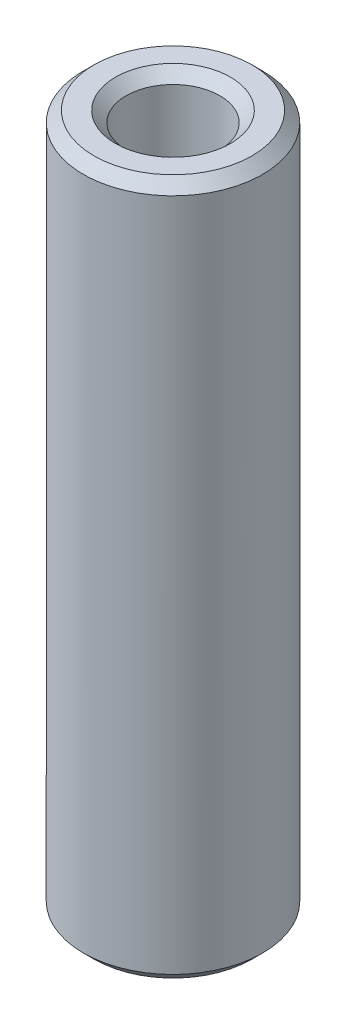
from build123d import *

# Parameters (mm, degrees)
SKETCH2_R           = 3.35
SKETCH2_R_2         = 1.75
BOSS_EXTRUDE1_DEPTH = 26
CHAMFER1_SIZE       = 0.4


with BuildPart() as part:
    # Sketch2 → Boss-Extrude1 (new body)
    with BuildSketch(Plane(origin=(0, 0, 0), x_dir=(1, 0, 0), z_dir=(0, 1, 0))):
        with Locations(Location((0, 0, 0), (0, 0, 90))):
            Circle(SKETCH2_R)
        with Locations(Location((0, 0, 0), (0, 0, 90))):
            Circle(SKETCH2_R_2, mode=Mode.SUBTRACT)
    extrude(amount=BOSS_EXTRUDE1_DEPTH)

    # Chamfer1
    chamfer1_edges = [part.edges().sort_by_distance(p)[0] for p in [
        (0, 0, 3.35),
        (0, 26, 3.35),
        (0, 0, 1.75),
        (0, 26, 1.75),
    ]]
    chamfer(chamfer1_edges, length=CHAMFER1_SIZE)


solid = part.part
